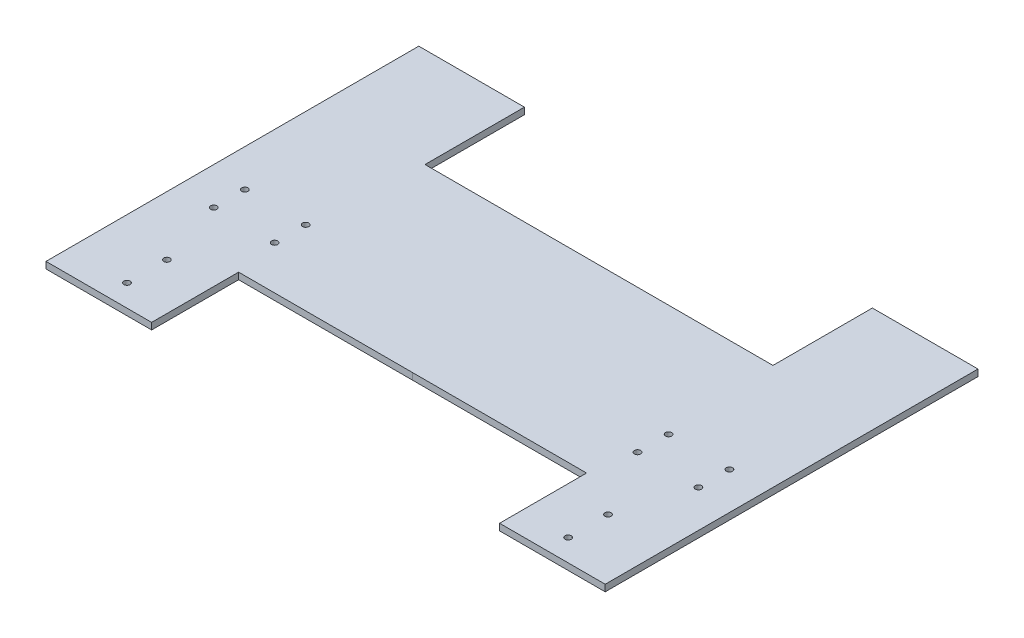
from build123d import *

# Parameters (mm, degrees)
SKETCH2_W                          = 450
SKETCH2_H                          = 300
BASE_DEPTH                         = 5.314
TAP_DRILL_FOR_M6X1_0_RACK_BOLTS_D  = 5
BACK_CUT_DEPTH                     = 271.468553802
TAP_DRILL_FOR_M6X1_0_MOTOR_BOLTS_D = 5
SKETCH10_W                         = 280
SKETCH10_H                         = 80
FRONT_CUT_DEPTH                    = 271.468553802


with BuildPart() as part:
    # Sketch2 → Base (new body)
    with BuildSketch(Plane(origin=(0, 0, 0), x_dir=(1, 0, 0), z_dir=(0, 1, 0))):
        Rectangle(SKETCH2_W, SKETCH2_H)
    extrude(amount=BASE_DEPTH)

    # Tap Drill for M6x1.0 rack bolts (through all)
    with Locations(Plane(origin=(0, 5.314, 0), x_dir=(1, 0, 0), z_dir=(0, 1, 0))):
        with Locations((-195, -45), (-146, -45), (-146, -20), (-195, -20), (146, -20), (195, -20), (195, -45), (146, -45)):
            Hole(TAP_DRILL_FOR_M6X1_0_RACK_BOLTS_D / 2)

    # Sketch7 → back cut (cut, through all)
    with BuildSketch(Plane(origin=(0, 5.314, 0), x_dir=(1, 0, 0), z_dir=(0, 1, 0))):
        Polygon((140, -80), (0, -80), (-140, -80), (-140, -150), (140, -150), align=None)
    extrude(amount=-BACK_CUT_DEPTH, mode=Mode.SUBTRACT)

    # Tap Drill for M6x1.0 motor bolts (through all)
    with Locations(Plane(origin=(0, 5.314, 0), x_dir=(1, 0, 0), z_dir=(0, 1, 0))):
        with Locations((-177.5, -100.252621879), (-177.5, -132.3413911), (177.5, -100.252621879), (177.5, -132.3413911)):
            Hole(TAP_DRILL_FOR_M6X1_0_MOTOR_BOLTS_D / 2)

    # Sketch10 → Front cut (cut, through all)
    with BuildSketch(Plane(origin=(0, 5.314, 0), x_dir=(1, 0, 0), z_dir=(0, 1, 0))):
        with Locations((0, 110)):
            Rectangle(SKETCH10_W, SKETCH10_H)
    extrude(amount=-FRONT_CUT_DEPTH, mode=Mode.SUBTRACT)


solid = part.part
